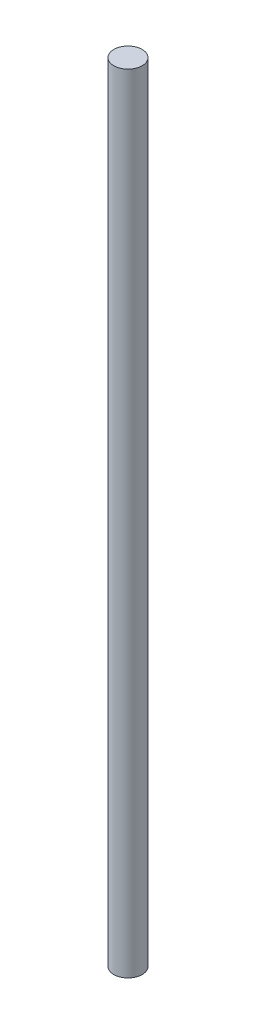
from build123d import *

# Parameters (mm, degrees)
SKETCH_1_R      = 3.6
EXTRUDE_2_DEPTH = 200


with BuildPart() as part:
    # 草图1 → 凸台-拉伸2 (new body)
    with BuildSketch(Plane(origin=(0, 0, 0), x_dir=(1, 0, 0), z_dir=(0, 1, 0))):
        with Locations(Location((0, 0, 0), (0, 0, 270))):
            Circle(SKETCH_1_R)
    extrude(amount=EXTRUDE_2_DEPTH)


solid = part.part
